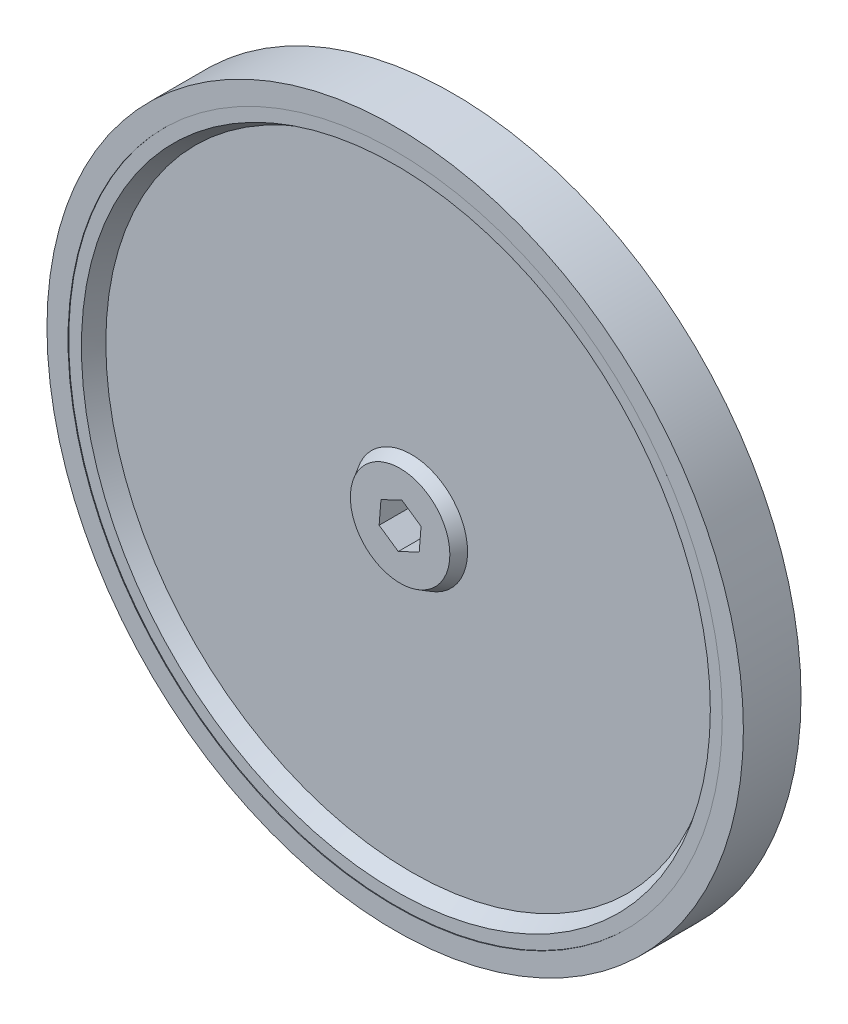
from build123d import *
from build123d.topology import SkipClean

# Parameters (mm, degrees)
SKETCH1_R           = 123.825
BOSS_EXTRUDE1_DEPTH = 10
SKETCH4_R           = 111.825
CUT_EXTRUDE1_DEPTH  = 5.5
CUT_EXTRUDE1_DRAFT  = -30
SKETCH5_R           = 111.825
CUT_EXTRUDE2_DEPTH  = 5.5
CUT_EXTRUDE2_DRAFT  = -30
SKETCH6_R           = 20
BOSS_EXTRUDE2_DEPTH = 4
BOSS_EXTRUDE2_TAPER = 30
SKETCH9_R           = 20
BOSS_EXTRUDE3_DEPTH = 4
BOSS_EXTRUDE3_TAPER = 30
CUT_EXTRUDE4_DEPTH  = 24
SKETCH11_R          = 123.825
SKETCH11_R_2        = 116.325
BOSS_EXTRUDE4_DEPTH = 0.25
BOSS_EXTRUDE5_START = 0.25
SKETCH13_R          = 123.825
SKETCH13_R_2        = 116.325
BOSS_EXTRUDE5_DEPTH = 0.25


with BuildPart() as part:
    # Sketch1 → Boss-Extrude1 (new, symmetric)
    with BuildSketch(Plane.XY):
        Circle(SKETCH1_R)
    extrude(amount=BOSS_EXTRUDE1_DEPTH, both=True)


with BuildPart() as cut_extrude1_tool:
    # Sketch4 → Cut-Extrude1 (with draft: the straight prism first)
    with BuildSketch(Plane.XY.offset(10)):
        Circle(SKETCH4_R)
    extrude(amount=-CUT_EXTRUDE1_DEPTH)
    # Cut-Extrude1: the draft: its side faces are tilted about the plane it starts from
    cut_extrude1_sides = [cut_extrude1_tool.faces().sort_by_distance(p)[0] for p in [
        (-111.825, 0, 7.25),
    ]]
    draft(cut_extrude1_sides, Plane.XY.offset(10), CUT_EXTRUDE1_DRAFT)


with BuildPart() as part_1:
    add(part.part)

    # Cut-Extrude1: cut by cut_extrude1_tool
    add(cut_extrude1_tool.part, mode=Mode.SUBTRACT)


with BuildPart() as cut_extrude2_tool:
    # Sketch5 → Cut-Extrude2 (with draft: the straight prism first)
    with BuildSketch(Plane(origin=(0, 0, -10), x_dir=(-1, 0, 0), z_dir=(0, 0, -1))):
        Circle(SKETCH5_R)
    extrude(amount=-CUT_EXTRUDE2_DEPTH)
    # Cut-Extrude2: the draft: its side faces are tilted about the plane it starts from
    cut_extrude2_sides = [cut_extrude2_tool.faces().sort_by_distance(p)[0] for p in [
        (111.825, 0, -7.25),
    ]]
    draft(cut_extrude2_sides, Plane(origin=(0, 0, -10), x_dir=(-1, 0, 0), z_dir=(0, 0, -1)), CUT_EXTRUDE2_DRAFT)


with BuildPart() as part_2:
    add(part_1.part)

    # Cut-Extrude2: cut by cut_extrude2_tool
    add(cut_extrude2_tool.part, mode=Mode.SUBTRACT)

    # Sketch6 → Boss-Extrude2 (add)
    with BuildSketch(Plane.XY.offset(4.5)):
        Circle(SKETCH6_R)
    extrude(amount=BOSS_EXTRUDE2_DEPTH, taper=BOSS_EXTRUDE2_TAPER)

    # Sketch9 → Boss-Extrude3 (add)
    with BuildSketch(Plane(origin=(0, 0, -4.5), x_dir=(-1, 0, 0), z_dir=(0, 0, -1))):
        Circle(SKETCH9_R)
    extrude(amount=BOSS_EXTRUDE3_DEPTH, taper=BOSS_EXTRUDE3_TAPER)

    # Sketch10 → Cut-Extrude4 (cut)
    with BuildSketch(Plane(origin=(0, 0, -8.5), x_dir=(-1, 0, 0), z_dir=(0, 0, -1))):
        Polygon((7.450577941, -3.554421662), (6.803508425, 4.675178938), (-0.647069515, 8.2296006), (-7.450577941, 3.554421662), (-6.803508425, -4.675178938), (0.647069515, -8.2296006), align=None)
    extrude(amount=-CUT_EXTRUDE4_DEPTH, mode=Mode.SUBTRACT)

    # Sketch11 → Boss-Extrude4 (add)
    with BuildSketch(Plane(origin=(0, 0, -10), x_dir=(-1, 0, 0), z_dir=(0, 0, -1))):
        Circle(SKETCH11_R)
        Circle(SKETCH11_R_2, mode=Mode.SUBTRACT)
    extrude(amount=BOSS_EXTRUDE4_DEPTH)

    # Sketch13 → Boss-Extrude5 (add)
    with SkipClean():  # the faces are left unmerged after this step: merging them gives an invalid solid
        with BuildSketch(Plane.XY.offset(10).offset(BOSS_EXTRUDE5_START)):
            with Locations(Location((0, 0, 0), (0, 0, 180))):
                Circle(SKETCH13_R)
            with Locations(Location((0, 0, 0), (0, 0, 180))):
                Circle(SKETCH13_R_2, mode=Mode.SUBTRACT)
        extrude(amount=-BOSS_EXTRUDE5_DEPTH)


solid = part_2.part
